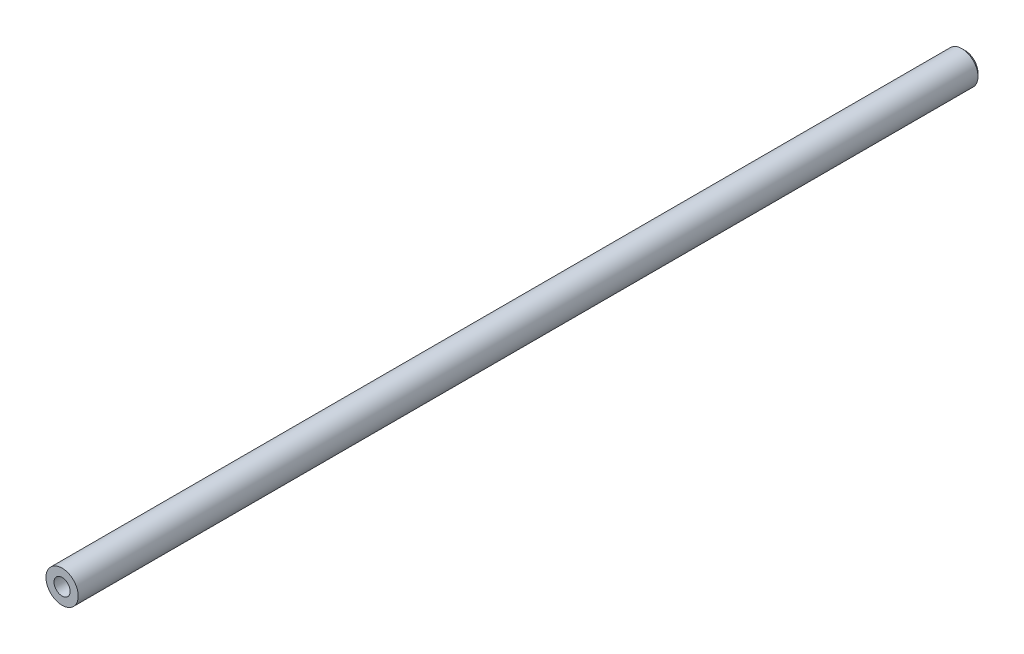
from build123d import *

# Parameters (mm, degrees)
CROQUIS1_R                = 5
SALIENTE_EXTRUIR1_DEPTH   = 140
TALADRO_ROSCADO_M61_D     = 5
TALADRO_ROSCADO_M61_DEPTH = 17
TALADRO_ROSCADO_M61_TIP   = 1.502151548
TALADRO_ROSCADO_M62_D     = 5
TALADRO_ROSCADO_M62_DEPTH = 17
TALADRO_ROSCADO_M62_TIP   = 1.502151548
CHAFL_N1_SIZE             = 1


with BuildPart() as part:
    # Croquis1 → Saliente-Extruir1 (new, symmetric)
    with BuildSketch(Plane.XY):
        Circle(CROQUIS1_R)
    extrude(amount=SALIENTE_EXTRUIR1_DEPTH, both=True)

    # Taladro roscado M61
    with Locations(Plane.XY.offset(140)):
        with Locations((0, 0)):
            Hole(TALADRO_ROSCADO_M61_D / 2, depth=TALADRO_ROSCADO_M61_DEPTH)
            with Locations((0, 0, -(TALADRO_ROSCADO_M61_DEPTH + TALADRO_ROSCADO_M61_TIP / 2))):  # 118° drill point
                Cone(0, TALADRO_ROSCADO_M61_D / 2, TALADRO_ROSCADO_M61_TIP, mode=Mode.SUBTRACT)

    # Taladro roscado M62
    with Locations(Plane(origin=(0, 0, -140), x_dir=(-1, 0, 0), z_dir=(0, 0, -1))):
        with Locations((0, 0)):
            Hole(TALADRO_ROSCADO_M62_D / 2, depth=TALADRO_ROSCADO_M62_DEPTH)
            with Locations((0, 0, -(TALADRO_ROSCADO_M62_DEPTH + TALADRO_ROSCADO_M62_TIP / 2))):  # 118° drill point
                Cone(0, TALADRO_ROSCADO_M62_D / 2, TALADRO_ROSCADO_M62_TIP, mode=Mode.SUBTRACT)

    # Chaflán1
    chafl_n1_edges = [part.edges().sort_by_distance(p)[0] for p in [
        (-5, 0, -140),
    ]]
    chamfer(chafl_n1_edges, length=CHAFL_N1_SIZE)


solid = part.part
